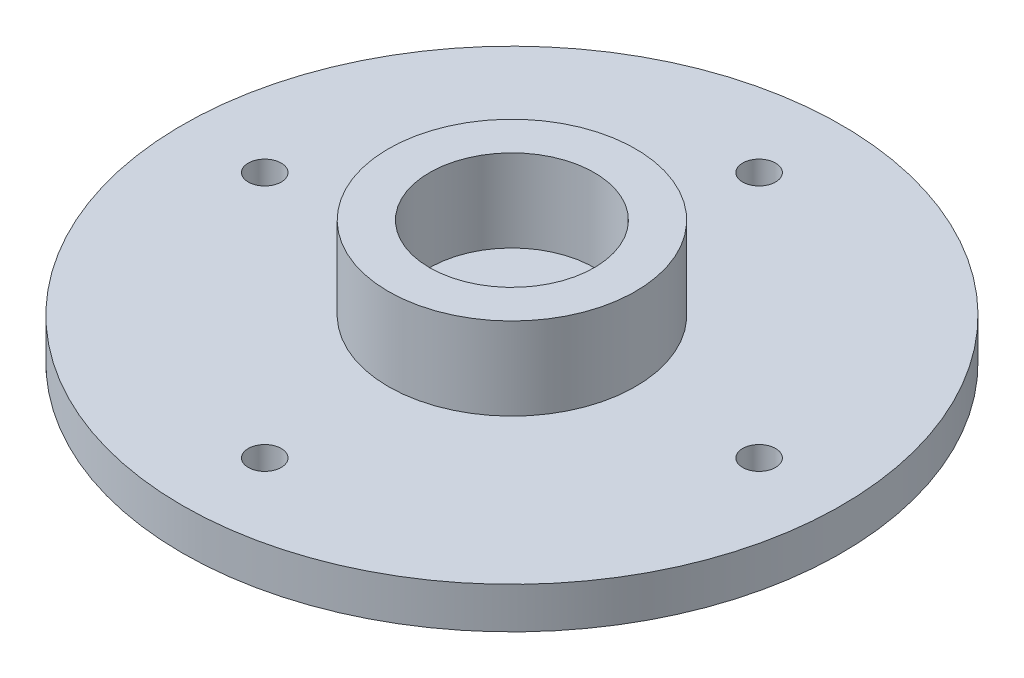
from build123d import *

# Parameters (mm, degrees)
SKETCH1_R           = 40
SKETCH1_R_2         = 2
BOSS_EXTRUDE1_DEPTH = 2.5
SKETCH2_R           = 15
SKETCH2_R_2         = 10
BOSS_EXTRUDE2_DEPTH = 10


with BuildPart() as part:
    # Sketch1 → Boss-Extrude1 (new, symmetric)
    with BuildSketch(Plane(origin=(0, 0, 0), x_dir=(1, 0, 0), z_dir=(0, 1, 0))):
        with Locations(Location((0, 0, 0), (0, 0, 270))):
            Circle(SKETCH1_R)
        with Locations(Location((0, 30, 0), (0, 0, 270))):
            Circle(SKETCH1_R_2, mode=Mode.SUBTRACT)
        with Locations(Location((30, 0, 0), (0, 0, 270))):
            Circle(SKETCH1_R_2, mode=Mode.SUBTRACT)
        with Locations(Location((0, -30, 0), (0, 0, 270))):
            Circle(SKETCH1_R_2, mode=Mode.SUBTRACT)
        with Locations(Location((-30, 0, 0), (0, 0, 270))):
            Circle(SKETCH1_R_2, mode=Mode.SUBTRACT)
    extrude(amount=BOSS_EXTRUDE1_DEPTH, both=True)

    # Sketch2 → Boss-Extrude2 (add)
    with BuildSketch(Plane(origin=(0, 2.5, 0), x_dir=(1, 0, 0), z_dir=(0, 1, 0))):
        with Locations(Location((0, 0, 0), (0, 0, 270))):
            Circle(SKETCH2_R)
        with Locations(Location((0, 0, 0), (0, 0, 270))):
            Circle(SKETCH2_R_2, mode=Mode.SUBTRACT)
    extrude(amount=BOSS_EXTRUDE2_DEPTH)


solid = part.part
